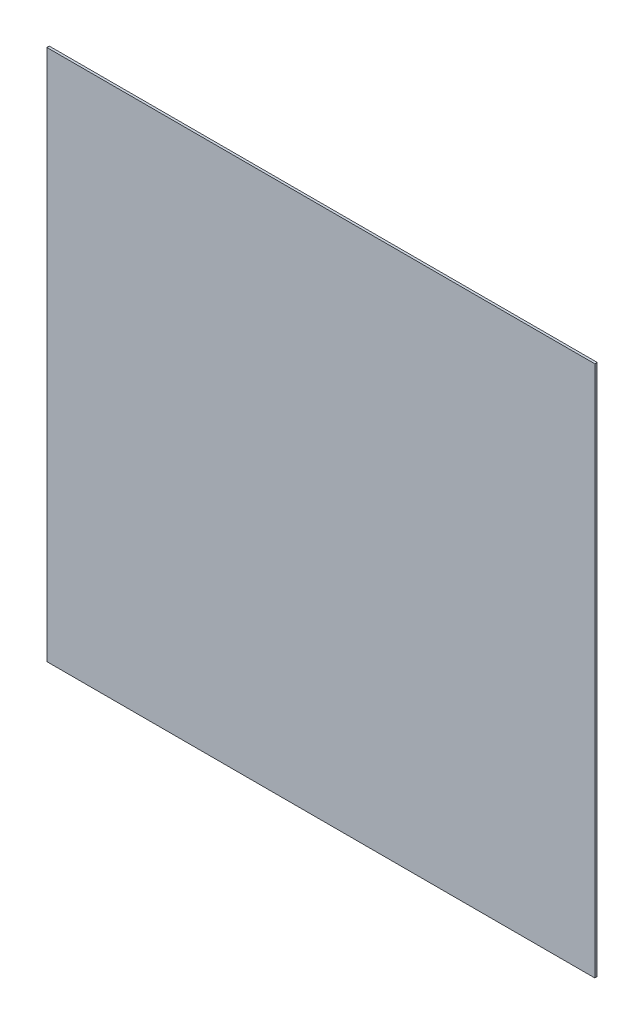
from build123d import *

# Parameters (mm, degrees)
SKETCH2_W           = 340
SKETCH2_H           = 330
BOSS_EXTRUDE2_DEPTH = 1.5


with BuildPart() as part:
    # Sketch2 → Boss-Extrude2 (new body)
    with BuildSketch(Plane.XY):
        Rectangle(SKETCH2_W, SKETCH2_H)
    extrude(amount=BOSS_EXTRUDE2_DEPTH)


solid = part.part
